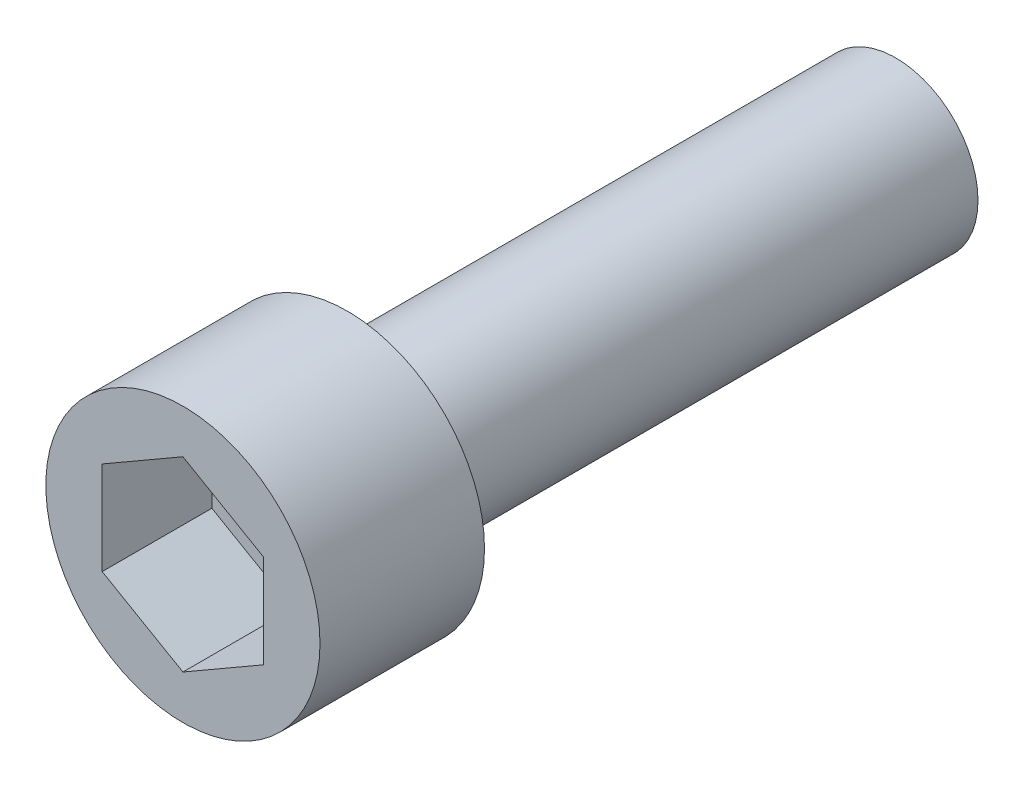
from build123d import *

# Parameters (mm, degrees)
SKETCH_1_R          = 1.5
EXTRUDE_1_DEPTH     = 10
SKETCH_2_R          = 2.5
EXTRUDE_2_DEPTH     = 3
CUT_EXTRUDE_1_DEPTH = 2


with BuildPart() as part:
    # 草图1 → 凸台-拉伸1 (new body)
    with BuildSketch(Plane.XY):
        Circle(SKETCH_1_R)
    extrude(amount=EXTRUDE_1_DEPTH)

    # 草图2 → 凸台-拉伸2 (add)
    with BuildSketch(Plane.XY.offset(10)):
        Circle(SKETCH_2_R)
    extrude(amount=EXTRUDE_2_DEPTH)

    # 草图3 → 切除-拉伸1 (cut)
    with BuildSketch(Plane.XY.offset(13)):
        Polygon((0, 1.7), (-1.472243186, 0.85), (-1.472243186, -0.85), (0, -1.7), (1.472243186, -0.85), (1.472243186, 0.85), align=None)
    extrude(amount=-CUT_EXTRUDE_1_DEPTH, mode=Mode.SUBTRACT)


solid = part.part
